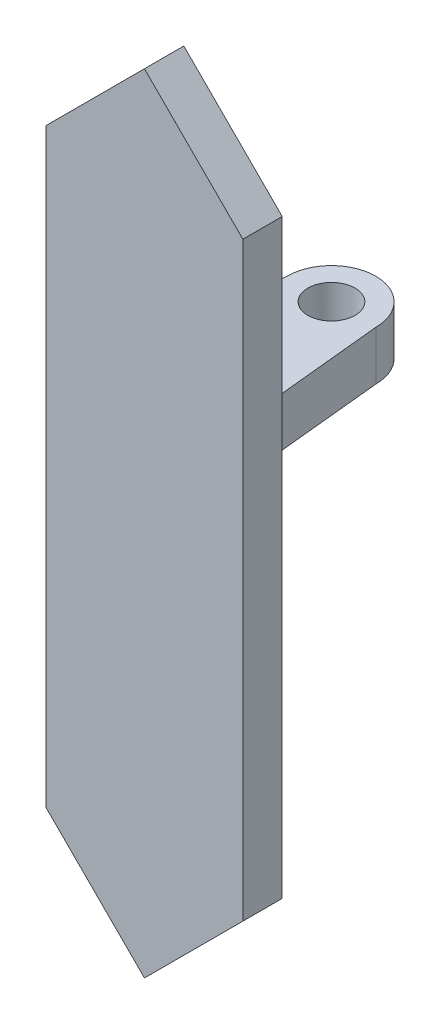
from build123d import *

# Parameters (mm, degrees)
EXTRUDE_1_DEPTH     = 4
SKETCH_2_W          = 12
SKETCH_2_H          = 5
EXTRUDE_2_DEPTH     = 20
SKETCH_6_R          = 2.4
CUT_EXTRUDE_5_DEPTH = 21


with BuildPart() as part:
    # 草图1 → 凸台-拉伸1 (new body)
    with BuildSketch(Plane.XY):
        Polygon((0.147281285, 10), (0.147281285, 70), (10.147281285, 80), (20.147281285, 70), (20.147281285, 10), (10.147281285, 0), align=None)
    extrude(amount=EXTRUDE_1_DEPTH)

    # 草图2 → 凸台-拉伸2 (add)
    with BuildSketch(Plane(origin=(0, 0, 0), x_dir=(-1, 0, 0), z_dir=(0, 0, -1))):
        with Locations((-10.147281285, 47.5)):
            Rectangle(SKETCH_2_W, SKETCH_2_H)
    extrude(amount=EXTRUDE_2_DEPTH)

    # 草图6 → 切除-拉伸5 (cut)
    with BuildSketch(Plane.XZ.offset(-45)):
        with Locations(Location((10.147281285, -15, 0), (0, 0, 270))):
            Circle(SKETCH_6_R)
        with BuildLine():
            ThreePointArc((14.647281285, -15), (10.147281285, -19.5), (5.647281285, -15))
            Line((5.647281285, -15), (4.147281285, 0))
            Line((4.147281285, 0), (4.147281285, -20))
            Line((4.147281285, -20), (16.147281285, -20))
            Line((16.147281285, -20), (16.147281285, 0))
            Line((16.147281285, 0), (14.647281285, -15))
        make_face()
    extrude(amount=-CUT_EXTRUDE_5_DEPTH, mode=Mode.SUBTRACT)


solid = part.part
